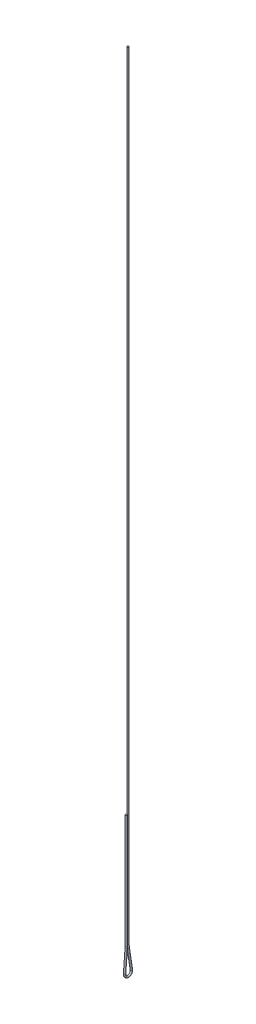
from build123d import *

# Parameters (mm, degrees)
SKETCH2_R = 0.75


with BuildPart() as part:
    # Sweep1: sweep along a path in Sketch1
    with BuildLine(Plane(origin=(0, 0, 0), x_dir=(0, 0, -1), z_dir=(1, 0, 0))) as sweep1_path:
        Line((0, 700), (0, 21.508533778))
        ThreePointArc((0, 21.508533778), (0.056650248, 20.004272941), (0.226280067, 18.508533778))
        Line((0.226280067, 18.508533778), (2.96605799, 0.45))
        ThreePointArc((2.96605799, 0.45), (0.112900451, -2.997874829), (-2.9915026, 0.225637305))
        Line((-2.9915026, 0.225637305), (-1.556649332, 19.248942344))
        ThreePointArc((-1.556649332, 19.248942344), (-1.514167351, 20.000533536), (-1.5, 20.753191044))
        Line((-1.5, 20.753191044), (-1.5, 120))
    # Sketch2 → Sweep1 (sweep)
    with BuildSketch(Plane(origin=(0, 120, 1.5), x_dir=(-1, 0, 0), z_dir=(0, 1, 0))):
        Circle(SKETCH2_R)
    sweep(path=sweep1_path.line)


solid = part.part
